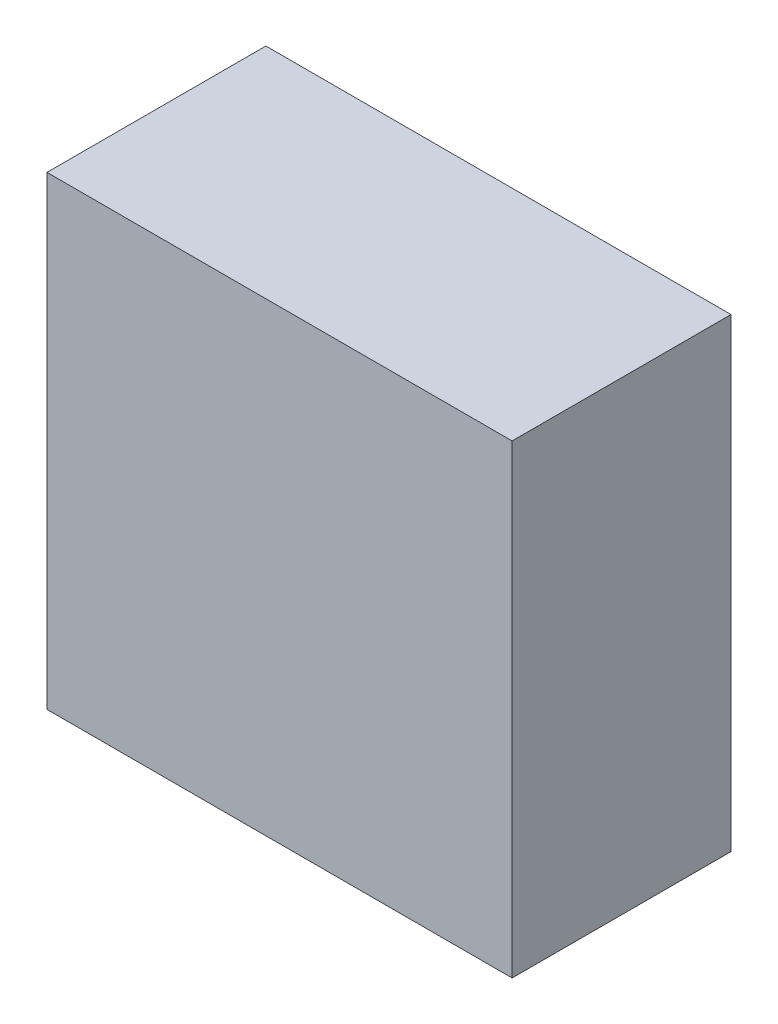
from build123d import *

# Parameters (mm, degrees)
SKETCH_1_W          = 34
SKETCH_1_H          = 34
EXTRUDE_1_DEPTH     = 16
SKETCH_3_R          = 1.5
CUT_EXTRUDE_1_DEPTH = 3


with BuildPart() as part:
    # 草图1 → 凸台-拉伸1 (new body)
    with BuildSketch(Plane.XY):
        Rectangle(SKETCH_1_W, SKETCH_1_H)
    extrude(amount=EXTRUDE_1_DEPTH)

    # 草图3 → 切除-拉伸1 (cut)
    with BuildSketch(Plane(origin=(0, 0, 0), x_dir=(-1, 0, 0), z_dir=(0, 0, -1))):
        Circle(SKETCH_3_R)
    extrude(amount=-CUT_EXTRUDE_1_DEPTH, mode=Mode.SUBTRACT)


solid = part.part
